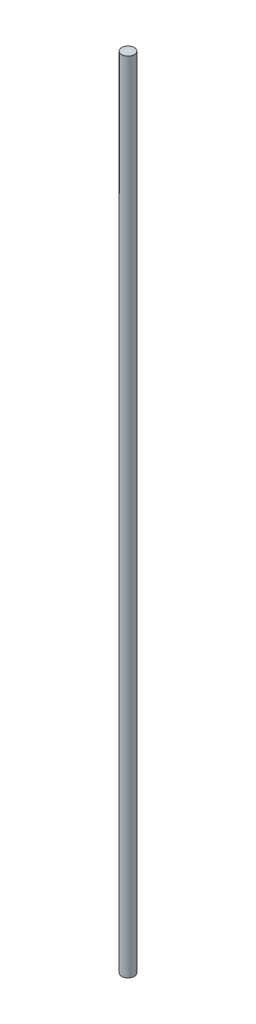
from build123d import *

# Parameters (mm, degrees)
SKETCH1_R           = 4
BOSS_EXTRUDE1_DEPTH = 510


with BuildPart() as part:
    # Sketch1 → Boss-Extrude1 (new body)
    with BuildSketch(Plane(origin=(0, 0, 0), x_dir=(1, 0, 0), z_dir=(0, 1, 0))):
        with Locations(Location((0, 0, 0), (0, 0, 270))):
            Circle(SKETCH1_R)
    extrude(amount=BOSS_EXTRUDE1_DEPTH)


solid = part.part
